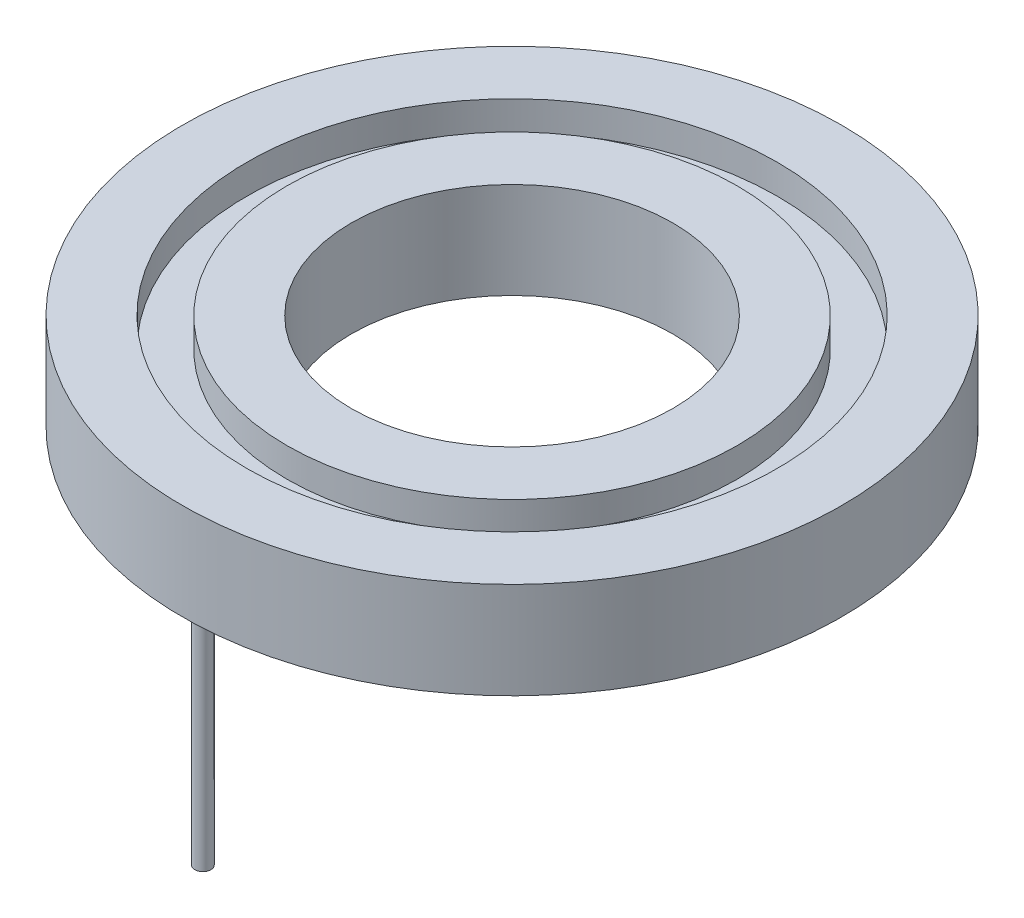
from build123d import *

# Parameters (mm, degrees)
SKETCH_2_R      = 1
EXTRUDE_1_DEPTH = 27


with BuildPart() as part:
    # 草图1 → 旋转1 (revolve)
    with BuildSketch(Plane.XY, mode=Mode.PRIVATE) as revolve_1_sk:
        Polygon((20, 0), (28, 0), (28, 3.662344451), (33, 3.662344451), (33, 0), (41, 0), (41, 12), (33, 12), (33, 8.337655549), (28, 8.337655549), (28, 11.96151904), (20, 11.96151904), align=None)
    revolve(revolve_1_sk.sketch.rotate(Axis((0, 0, 0), (0, 1, 0)), 90), axis=Axis((0, 0, 0), (0, 1, 0)))

    # 草图2 → 凸台-拉伸1 (add)
    with BuildSketch(Plane.XZ):
        with Locations(Location((0.996647287, 39.458172136, 0), (0, 0, 270))):
            Circle(SKETCH_2_R)
    extrude(amount=EXTRUDE_1_DEPTH)


solid = part.part
